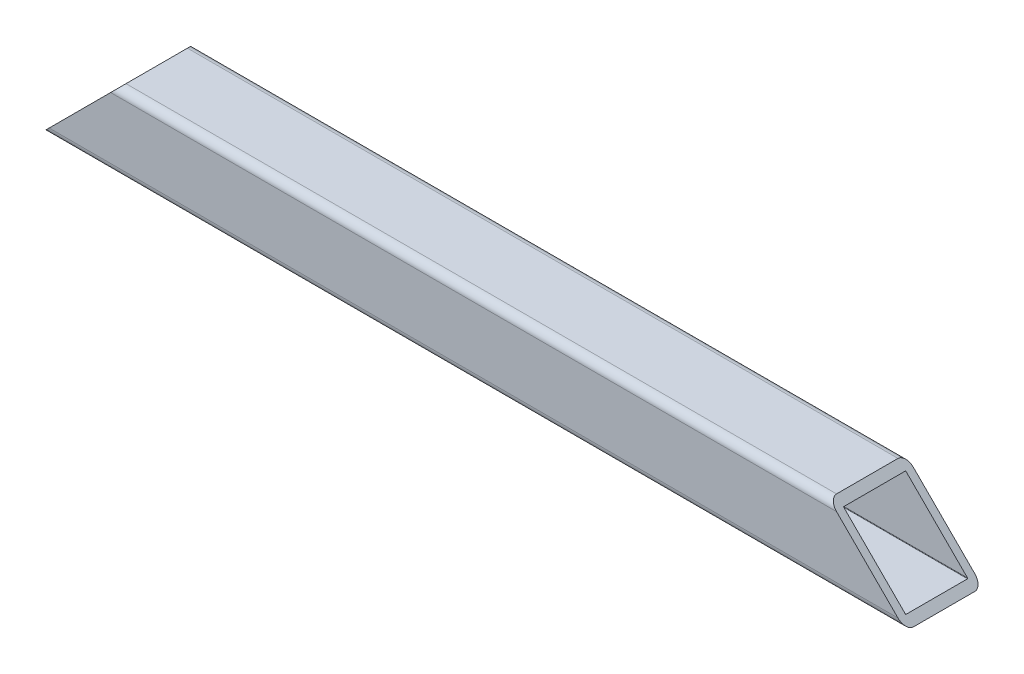
from build123d import *

# Parameters (mm, degrees)
SQUARE_TUBE_CONFIGURED_2_X_2_X_0_25_1_DEPTH = 285.75
CUT_EXTRUDE1_DEPTH                          = 218.733740656
CUT_EXTRUDE1_DEPTH_BACK                     = 218.733740656


with BuildPart() as part:
    # Sketch11 → Square tube - configured 2 X 2 X 0.25(1) (new body)
    with BuildSketch(Plane.YZ.offset(-68.758290896)):
        with BuildLine():
            Line((-10.16, -12.7), (10.16, -12.7))
            ThreePointArc((10.16, -12.7), (11.956051224, -11.956051224), (12.7, -10.16))
            Line((12.7, -10.16), (12.7, 10.16))
            ThreePointArc((12.7, 10.16), (11.956051224, 11.956051224), (10.16, 12.7))
            Line((10.16, 12.7), (-10.16, 12.7))
            ThreePointArc((-10.16, 12.7), (-11.956051224, 11.956051224), (-12.7, 10.16))
            Line((-12.7, 10.16), (-12.7, -10.16))
            ThreePointArc((-12.7, -10.16), (-11.956051224, -11.956051224), (-10.16, -12.7))
        make_face()
        with BuildLine():
            Line((-10.16, -10.287), (10.16, -10.287))
            ThreePointArc((10.16, -10.287), (10.249802561, -10.249802561), (10.287, -10.16))
            Line((10.287, -10.16), (10.287, 10.16))
            ThreePointArc((10.287, 10.16), (10.249802561, 10.249802561), (10.16, 10.287))
            Line((10.16, 10.287), (-10.16, 10.287))
            ThreePointArc((-10.16, 10.287), (-10.249802561, 10.249802561), (-10.287, 10.16))
            Line((-10.287, 10.16), (-10.287, -10.16))
            ThreePointArc((-10.287, -10.16), (-10.249802561, -10.249802561), (-10.16, -10.287))
        make_face(mode=Mode.SUBTRACT)
    extrude(amount=SQUARE_TUBE_CONFIGURED_2_X_2_X_0_25_1_DEPTH)

    # Sketch12 → Cut-Extrude1 (cut, two sides: drawn at the far end of the back side and taken through both)
    with BuildSketch(Plane.XY.offset(-CUT_EXTRUDE1_DEPTH_BACK)):
        Polygon((-68.758290896, -12.7), (-43.358290896, 12.7), (-68.758290896, 12.7), align=None)
        Polygon((216.991709104, -12.7), (191.591709104, 12.7), (216.991709104, 12.7), align=None)
    extrude(amount=CUT_EXTRUDE1_DEPTH + CUT_EXTRUDE1_DEPTH_BACK, mode=Mode.SUBTRACT)


solid = part.part
